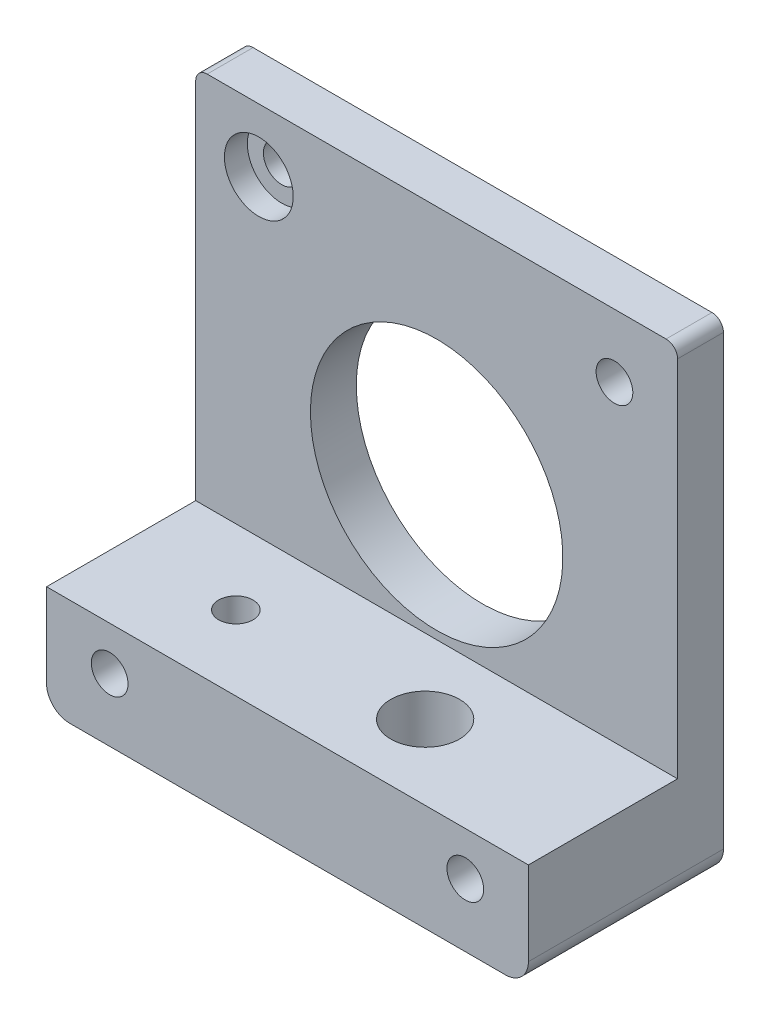
from build123d import *

# Parameters (mm, degrees)
SKETCH1_W                                        = 42
SKETCH1_H                                        = 42
BOSS_EXTRUDE1_DEPTH                              = 17
SKETCH2_W                                        = 13
SKETCH2_H                                        = 32.7
CUT_EXTRUDE1_DEPTH                               = 49.30836175
F_22_0_22_DIAMETER_HOLE1_D                       = 22
F_22_0_22_DIAMETER_HOLE1_DEPTH                   = 17
F_3_2_3_2_DIAMETER_HOLE1_D                       = 3.2
F_3_2_3_2_DIAMETER_HOLE1_DEPTH                   = 17
F_3_2_3_2_DIAMETER_HOLE2_D                       = 3.2
F_6_0_6_DIAMETER_HOLE1_D                         = 6
F_6_0_6_DIAMETER_HOLE1_DEPTH                     = 42
F_3_0_3_DIAMETER_HOLE1_D                         = 3
F_3_0_3_DIAMETER_HOLE1_DEPTH                     = 42
CBORE_FOR_M3_HEX_HEAD_MACHINE_SCREW1_D           = 3.2
CBORE_FOR_M3_HEX_HEAD_MACHINE_SCREW1_CBORE_D     = 6
CBORE_FOR_M3_HEX_HEAD_MACHINE_SCREW1_CBORE_DEPTH = 2
FILLET1_R                                        = 1
FILLET2_R                                        = 2


with BuildPart() as part:
    # Sketch1 → Boss-Extrude1 (new body)
    with BuildSketch(Plane(origin=(0, 0, -8.5), x_dir=(-1, 0, 0), z_dir=(0, 0, -1))):
        with Locations((3.196772144, -1.303538171)):
            Rectangle(SKETCH1_W, SKETCH1_H)
    extrude(amount=-BOSS_EXTRUDE1_DEPTH)

    # Sketch2 → Cut-Extrude1 (cut, through all)
    with BuildSketch(Plane(origin=(17.803227856, 0, 0), x_dir=(0, 0, -1), z_dir=(1, 0, 0))):
        with Locations((-2, 3.346461829)):
            Rectangle(SKETCH2_W, SKETCH2_H)
    extrude(amount=-CUT_EXTRUDE1_DEPTH, mode=Mode.SUBTRACT)

    # Ø22.0 (22) Diameter Hole1
    with Locations(Plane(origin=(0, 0, -8.5), x_dir=(-1, 0, 0), z_dir=(0, 0, -1))):
        with Locations((3.196772144, -1.303538171)):
            Hole(F_22_0_22_DIAMETER_HOLE1_D / 2, depth=F_22_0_22_DIAMETER_HOLE1_DEPTH)

    # Ø3.2 (3.2) Diameter Hole1
    with Locations(Plane(origin=(0, 0, -8.5), x_dir=(-1, 0, 0), z_dir=(0, 0, -1))):
        with Locations((-12.303227856, 14.196461829)):
            Hole(F_3_2_3_2_DIAMETER_HOLE1_D / 2, depth=F_3_2_3_2_DIAMETER_HOLE1_DEPTH)

    # Ø3.2 (3.2) Diameter Hole2 (through all)
    with Locations(Plane.XY.offset(8.5)):
        with Locations((-18.696772144, -16.803538171), (12.303227856, -16.803538171)):
            Hole(F_3_2_3_2_DIAMETER_HOLE2_D / 2)

    # Ø6.0 (6) Diameter Hole1
    with Locations(Plane(origin=(0, -22.303538171, 0), x_dir=(-1, 0, 0), z_dir=(0, -1, 0))):
        with Locations((-2.303227856, -2)):
            Hole(F_6_0_6_DIAMETER_HOLE1_D / 2, depth=F_6_0_6_DIAMETER_HOLE1_DEPTH)

    # Ø3.0 (3) Diameter Hole1
    with Locations(Plane(origin=(0, -22.303538171, 0), x_dir=(-1, 0, 0), z_dir=(0, -1, 0))):
        with Locations((14.196772144, -2)):
            Hole(F_3_0_3_DIAMETER_HOLE1_D / 2, depth=F_3_0_3_DIAMETER_HOLE1_DEPTH)

    # CBORE for M3 Hex Head Machine Screw1 (through all)
    with Locations(Plane.XY.offset(-4.5)):
        with Locations((-18.696772144, 14.196461829)):
            CounterBoreHole(CBORE_FOR_M3_HEX_HEAD_MACHINE_SCREW1_D / 2, CBORE_FOR_M3_HEX_HEAD_MACHINE_SCREW1_CBORE_D / 2, CBORE_FOR_M3_HEX_HEAD_MACHINE_SCREW1_CBORE_DEPTH)

    # Fillet1
    fillet1_edges = [part.edges().sort_by_distance(p)[0] for p in [
        (-24.196772144, 19.696461829, -6.5),
        (17.803227856, 19.696461829, -6.5),
    ]]
    fillet(fillet1_edges, radius=FILLET1_R)

    # Fillet2
    fillet2_edges = [part.edges().sort_by_distance(p)[0] for p in [
        (17.803227856, -22.303538171, 0),
        (-24.196772144, -22.303538171, 0),
    ]]
    fillet(fillet2_edges, radius=FILLET2_R)


solid = part.part
